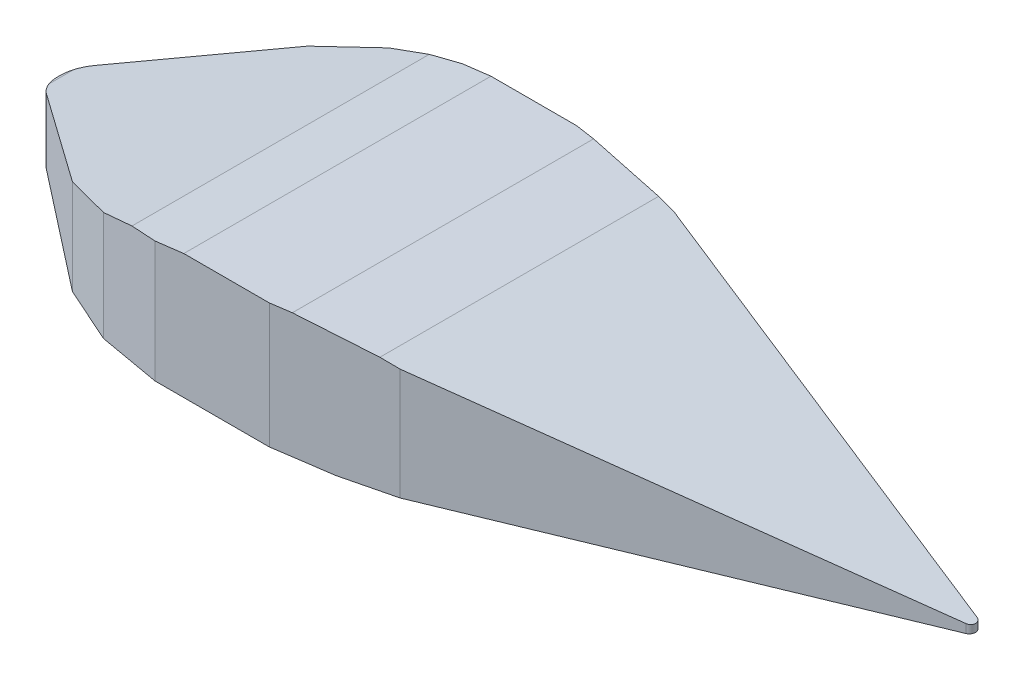
from build123d import *

# Parameters (mm, degrees)
TOPVIEW_EXTRUDE_DEPTH      = 800
SIDEPROFILE_CUT_DEPTH      = 5006.734380578
SIDEPROFILE_CUT_DEPTH_BACK = 5006.734380578
SKETCH3_OUTSIDE_W          = 5798.358
SKETCH3_OUTSIDE_H          = 1822.06


with BuildPart() as part:
    # Sketch1 → TopView_Extrude (new body)
    with BuildSketch(Plane(origin=(0, 0, 0), x_dir=(1, 0, 0), z_dir=(0, 1, 0))):
        with BuildLine():
            Line((161.409759475, 126.088702216), (784.13, 612.54))
            Line((784.13, 612.54), (1076.464, 742.696))
            Line((1076.464, 742.696), (1401.451, 800))
            Line((1401.451, 800), (1997.019, 800))
            Line((1997.019, 800), (2590.582, 712.35))
            Line((2590.582, 712.35), (4854.876103105, 28.719585912))
            ThreePointArc((4854.876103105, 28.719585912), (4876.205152462, 0), (4854.876103105, -28.719585912))
            Line((4854.876103105, -28.719585912), (2590.582, -712.35))
            Line((2590.582, -712.35), (1997.019, -800))
            Line((1997.019, -800), (1401.451, -800))
            Line((1401.451, -800), (1076.464, -742.696))
            Line((1076.464, -742.696), (784.13, -612.54))
            Line((784.13, -612.54), (161.409759475, -126.088702216))
            ThreePointArc((161.409759475, -126.088702216), (99.906658784, 0), (161.409759475, 126.088702216))
        make_face()
    extrude(amount=TOPVIEW_EXTRUDE_DEPTH)

    # Sketch3 outside → SideProfile_Cut (cut, two sides: drawn at the far end of the back side and taken through both)
    with BuildSketch(Plane.XY.offset(-SIDEPROFILE_CUT_DEPTH_BACK)):
        with Locations((2488.056, 400)):
            Rectangle(SKETCH3_OUTSIDE_W, SKETCH3_OUTSIDE_H)
        with BuildLine():
            Line((0, 300), (0, 332.854109989))
            ThreePointArc((0, 332.854109989), (31.780435884, 425.180350356), (113.655128803, 478.384348558))
            Line((113.655128803, 478.384348558), (1255.921, 763.655))
            Line((1255.921, 763.655), (1551.451, 800))
            Line((1551.451, 800), (2101.451, 800))
            Line((2101.451, 800), (2499.002, 768.799))
            Line((2499.002, 768.799), (4950, 381.685))
            Line((4950, 381.685), (4950, 359.158))
            Line((4950, 359.158), (2301.451, 150))
            Line((2301.451, 150), (150, 150))
            ThreePointArc((150, 150), (43.933982822, 193.933982822), (0, 300))
        make_face(mode=Mode.SUBTRACT)
    extrude(amount=SIDEPROFILE_CUT_DEPTH + SIDEPROFILE_CUT_DEPTH_BACK, mode=Mode.SUBTRACT)


solid = part.part
